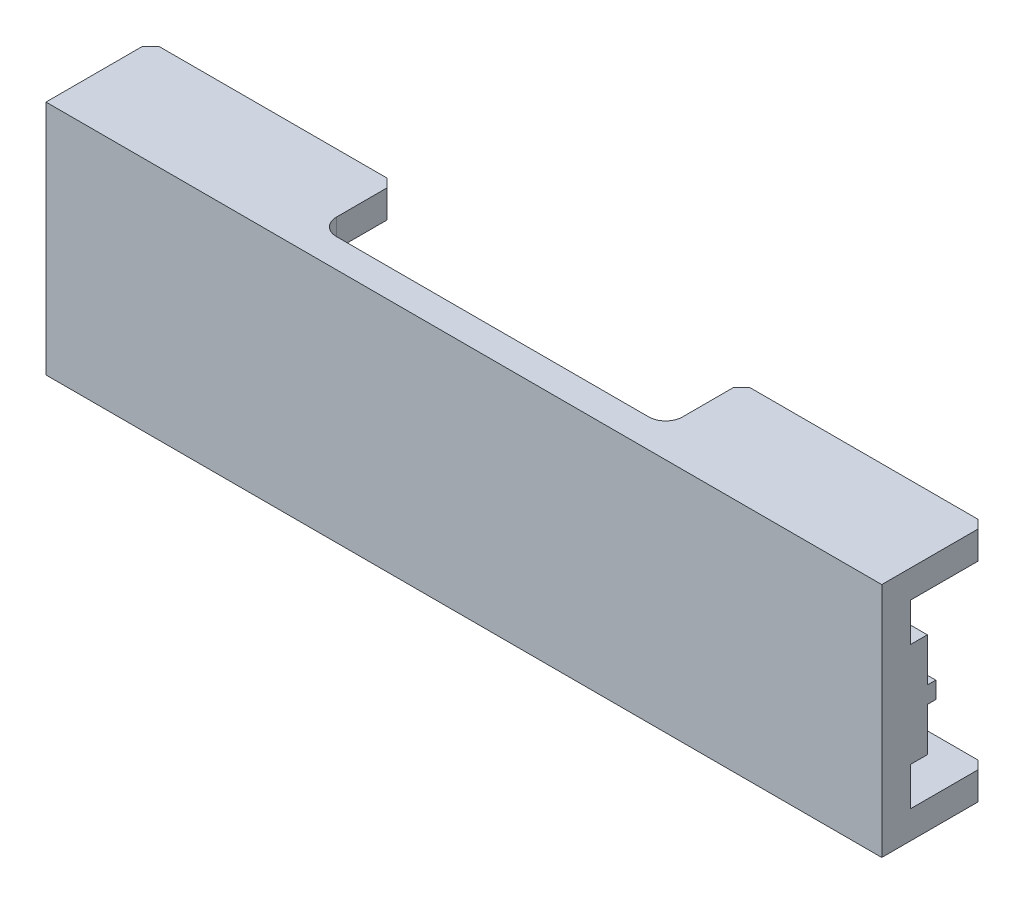
from build123d import *

# Parameters (mm, degrees)
SKETCH1_W           = 99
SKETCH1_H           = 28
BOSS_EXTRUDE1_DEPTH = 2.5
SKETCH2_W           = 29
SKETCH2_H           = 7
BOSS_EXTRUDE2_DEPTH = 3.3
FILLET1_R           = 2
SKETCH5_W           = 99
SKETCH5_H           = 9
BOSS_EXTRUDE3_DEPTH = 2
MOVE_FACE2_BY       = 2
MOVE_FACE2_2_BY     = 2
CHAMFER1_SIZE       = 1
SKETCH6_W           = 99
SKETCH6_H           = 2
BOSS_EXTRUDE4_DEPTH = 1
MOVE_FACE3_BY       = 0.9


with BuildPart() as part:
    # Sketch1 → Boss-Extrude1 (new body)
    with BuildSketch(Plane.XY):
        with Locations((75, 10)):
            Rectangle(SKETCH1_W, SKETCH1_H)
    extrude(amount=BOSS_EXTRUDE1_DEPTH)

    # Sketch2 → Boss-Extrude2 (add)
    with BuildSketch(Plane.XZ.offset(4)):
        with Locations((40, -3.5)):
            Rectangle(SKETCH2_W, SKETCH2_H)
        with Locations((110, -3.5)):
            Rectangle(SKETCH2_W, SKETCH2_H)
    extrude(amount=-BOSS_EXTRUDE2_DEPTH)

    # Fillet1
    fillet1_edges = [part.edges().sort_by_distance(p)[0] for p in [
        (54.5, -2.35, 0),
        (95.5, -2.35, 0),
    ]]
    fillet(fillet1_edges, radius=FILLET1_R)

    # Sketch5 → Boss-Extrude3 (add)
    with BuildSketch(Plane(origin=(0, 0, 0), x_dir=(-1, 0, 0), z_dir=(0, 0, -1))):
        with Locations((-75, 11.65)):
            Rectangle(SKETCH5_W, SKETCH5_H)
    extrude(amount=BOSS_EXTRUDE3_DEPTH)

    # Move Face2: a face moved outward by 2.0
    extrude(part.faces().sort_by_distance((40, -2.35, -7))[0], amount=MOVE_FACE2_BY, dir=(0, 0, -1))

    # Move Face2 2: a face moved outward by 2.0
    extrude(part.faces().sort_by_distance((110, -2.35, -7))[0], amount=MOVE_FACE2_2_BY, dir=(0, 0, -1))

    # Chamfer1
    chamfer1_edges = [part.edges().sort_by_distance(p)[0] for p in [
        (54.5, -2.35, -9),
        (25.5, -2.35, -9),
        (95.5, -2.35, -9),
        (124.5, -2.35, -9),
    ]]
    chamfer(chamfer1_edges, length=CHAMFER1_SIZE)

    # Mirror1: part across plane


with BuildPart() as part_1:
    add(part.part)
    add(part.part.mirror(Plane(origin=(0, 10, 0), x_dir=(0, 0, 1), z_dir=(0, -1, 0))))

    # Sketch6 → Boss-Extrude4 (add)
    with BuildSketch(Plane(origin=(0, 0, -2), x_dir=(-1, 0, 0), z_dir=(0, 0, -1))):
        with Locations((-75, 10)):
            Rectangle(SKETCH6_W, SKETCH6_H)
    extrude(amount=BOSS_EXTRUDE4_DEPTH)

    # Move Face3: a face moved outward by 0.9
    extrude(part_1.faces().sort_by_distance((75, 10, 2.5))[0], amount=MOVE_FACE3_BY, dir=(0, 0, 1))


solid = part_1.part
